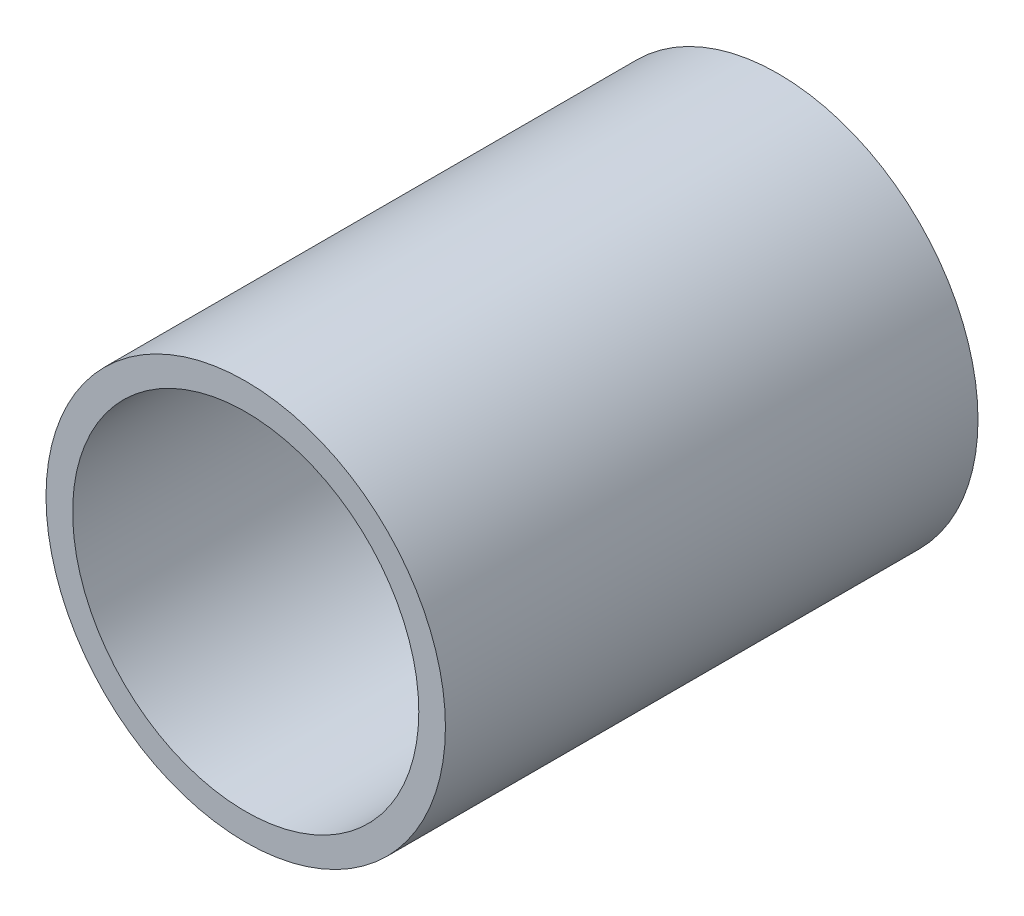
from build123d import *

# Parameters (mm, degrees)
SKETCH1_R           = 7.5
SKETCH1_R_2         = 6.5
BOSS_EXTRUDE1_DEPTH = 20


with BuildPart() as part:
    # Sketch1 → Boss-Extrude1 (new body)
    with BuildSketch(Plane.XY):
        Circle(SKETCH1_R)
        Circle(SKETCH1_R_2, mode=Mode.SUBTRACT)
    extrude(amount=BOSS_EXTRUDE1_DEPTH)


solid = part.part
